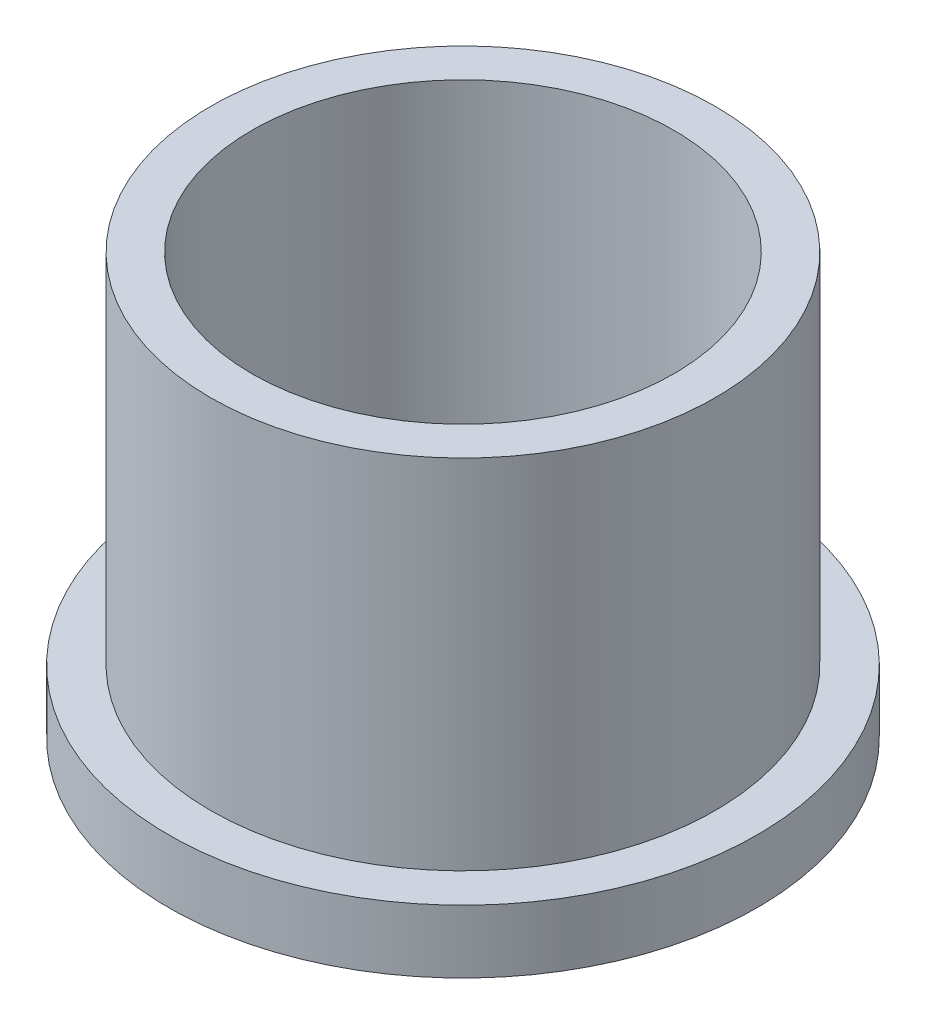
from build123d import *

# Parameters (mm, degrees)
SKETCH2_R           = 19.05
SKETCH2_R_2         = 15.9258
BOSS_EXTRUDE1_DEPTH = 31.75
SKETCH3_R           = 22.225
SKETCH3_R_2         = 19.05
BOSS_EXTRUDE2_DEPTH = 4.7625


with BuildPart() as part:
    # Sketch2 → Boss-Extrude1 (new body)
    with BuildSketch(Plane(origin=(0, 0, 0), x_dir=(1, 0, 0), z_dir=(0, 1, 0))):
        with Locations(Location((0, 0, 0), (0, 0, 270))):
            Circle(SKETCH2_R)
        with Locations(Location((0, 0, 0), (0, 0, 270))):
            Circle(SKETCH2_R_2, mode=Mode.SUBTRACT)
    extrude(amount=BOSS_EXTRUDE1_DEPTH)

    # Sketch3 → Boss-Extrude2 (add)
    with BuildSketch(Plane(origin=(0, 0, 0), x_dir=(1, 0, 0), z_dir=(0, 1, 0))):
        with Locations(Location((0, 0, 0), (0, 0, 90))):
            Circle(SKETCH3_R)
        with Locations(Location((0, 0, 0), (0, 0, 270))):
            Circle(SKETCH3_R_2, mode=Mode.SUBTRACT)
    extrude(amount=BOSS_EXTRUDE2_DEPTH)


solid = part.part
